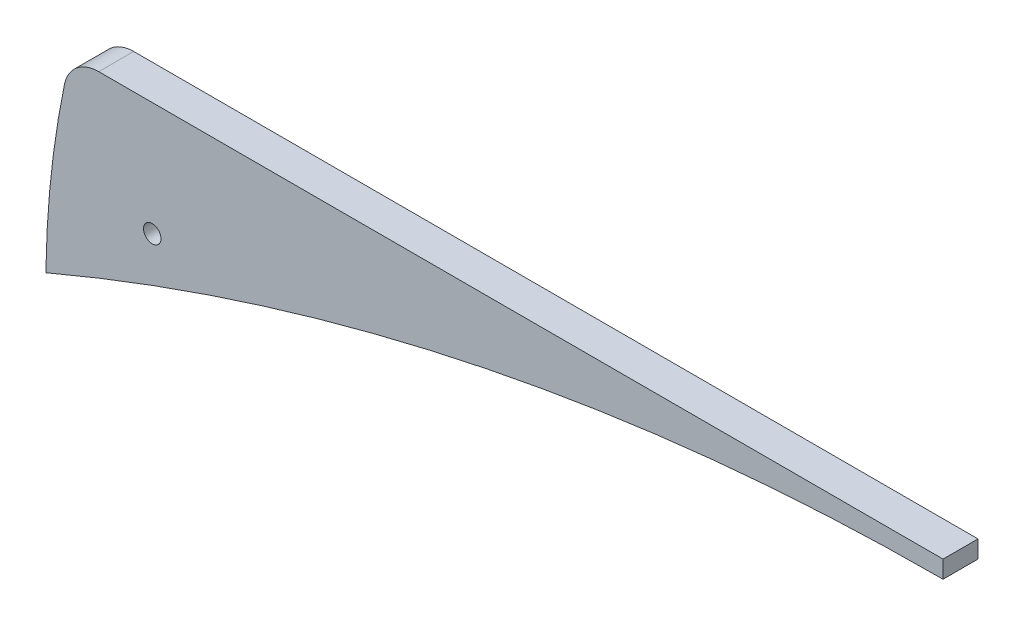
from build123d import *

# Parameters (mm, degrees)
SKICA1_R                = 0.5
P_IDAT_VYSUNUT_M1_DEPTH = 2


with BuildPart() as part:
    # Skica1 → Přidat vysunutím1 (new body)
    with BuildSketch(Plane.XY):
        with BuildLine():
            Line((0, 11), (0, 12))
            Line((0, 12), (-48.307823831, 12))
            ThreePointArc((-48.307823831, 12), (-49.570592062, 11.550940487), (-50.266302206, 10.405416394))
            ThreePointArc((-50.266302206, 10.405416394), (-51.024263074, 5.612344033), (-51.326233925, 0.769115673))
            ThreePointArc((-51.326233925, 0.769115673), (-51.324464931, 0.649874315), (-51.31559221, 0.530950366))
            ThreePointArc((-51.31559221, 0.530950366), (-26.186308465, 8.356056534), (0, 11))
        make_face()
        with Locations((-45.246630015, 5.5)):
            Circle(SKICA1_R, mode=Mode.SUBTRACT)
    extrude(amount=P_IDAT_VYSUNUT_M1_DEPTH)


solid = part.part
